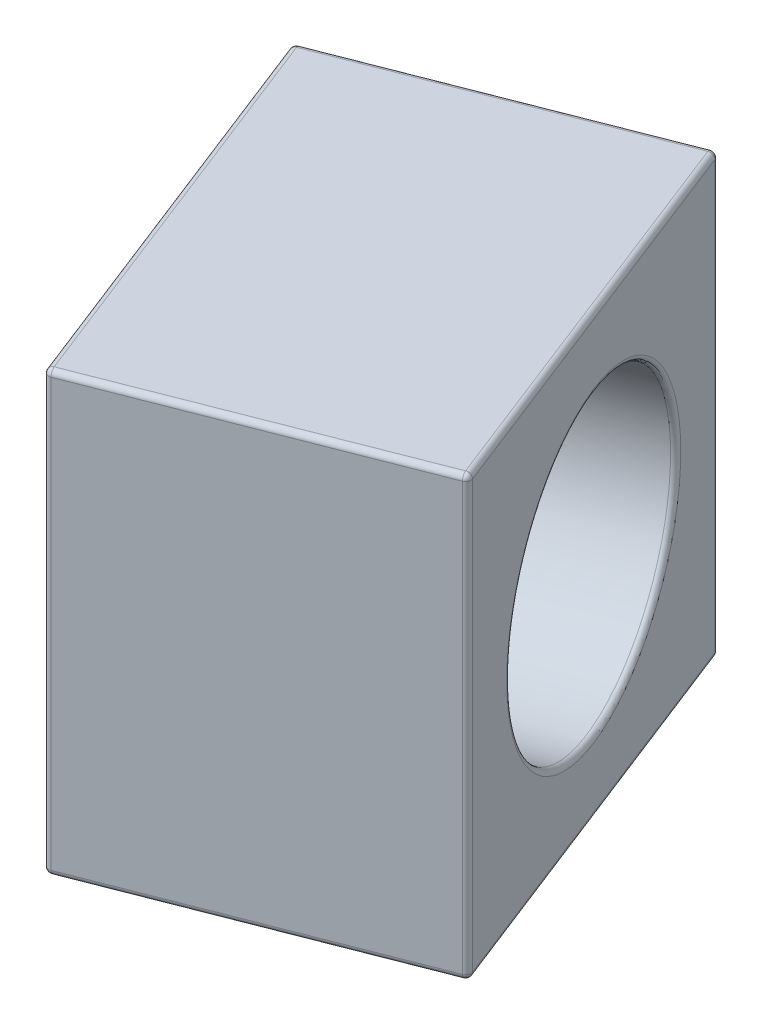
from build123d import *

# Parameters (mm, degrees)
BOSS_EXTRUDE1_DEPTH      = 20
BOSS_EXTRUDE1_DEPTH_BACK = 20
CUT_SWEEP1_PROFILE_R     = 13.5
CUT_SWEEP2_PROFILE_R     = 6
FILLET1_R                = 0.5


with BuildPart() as part:
    # Sketch20 → Boss-Extrude1 (new, two sides: drawn at the far end of the back side and taken through both)
    with BuildSketch(Plane(origin=(0, 0, 0), x_dir=(1, 0, 0), z_dir=(0, 1, 0)).offset(-BOSS_EXTRUDE1_DEPTH_BACK)):
        Polygon((271.030924973, 98.268326166), (298.972363284, 109.189682542), (284.410554783, 146.444933624), (256.469116472, 135.523577248), align=None)
    extrude(amount=BOSS_EXTRUDE1_DEPTH + BOSS_EXTRUDE1_DEPTH_BACK)

    # Cut-Sweep1: sweep along a path in Sketch6
    with BuildLine(Plane(origin=(0, 0, 0), x_dir=(1, 0, 0), z_dir=(0, 1, 0))) as cut_sweep1_path:
        Line((27.911860583, 24.714849031), (544.640102873, 226.686315947))
    # Cut-Sweep1 profile (on start of the path) → Cut-Sweep1 (sweep, cut)
    with BuildSketch(Plane(origin=(27.911860583, 0, -24.714849031), x_dir=(0.3640452125264868, 0, 0.931381277048527), z_dir=(0.931381277048527, 0, -0.3640452125264868))):
        Circle(CUT_SWEEP1_PROFILE_R)
    sweep(path=cut_sweep1_path.line, mode=Mode.SUBTRACT)

    # Cut-Sweep2: sweep along a path in Sketch19
    with BuildLine(Plane(origin=(0, 0, 0), x_dir=(1, 0, 0), z_dir=(0, 1, 0))) as cut_sweep2_path:
        Line((128.459886798, 309.266363493), (271.805005174, 137.491575647))
    # Cut-Sweep2 profile (on start of the path) → Cut-Sweep2 (sweep, cut)
    with BuildSketch(Plane(origin=(128.459886798, 0, -309.266363493), x_dir=(0.767782639292157, 0, -0.6407104016648784), z_dir=(0.6407104016648784, 0, 0.767782639292157))):
        Circle(CUT_SWEEP2_PROFILE_R)
    sweep(path=cut_sweep2_path.line, mode=Mode.SUBTRACT)

    # Fillet1
    fillet1_edges = [part.edges().sort_by_distance(p)[0] for p in [
        (291.691459034, -20, -127.817308083),
        (291.691459034, 20, -127.817308083),
        (285.001644128, -20, -103.729004354),
        (285.001644128, 20, -103.729004354),
        (298.972363284, 0, -109.189682542),
        (263.750020722, -20, -116.895951707),
        (263.750020722, 20, -116.895951707),
        (271.030924973, 0, -98.268326166),
        (258.835410353, 0, -129.469598947),
        (270.439835627, -20, -140.984255436),
        (284.410554783, 0, -146.444933624),
        (270.439835627, 20, -140.984255436),
        (256.469116472, 0, -135.523577248),
        (263.37880602, -1.3026e-05, -138.224339505),
        (286.776848665, 0, -140.390955323),
    ]]
    fillet(fillet1_edges, radius=FILLET1_R)


solid = part.part
